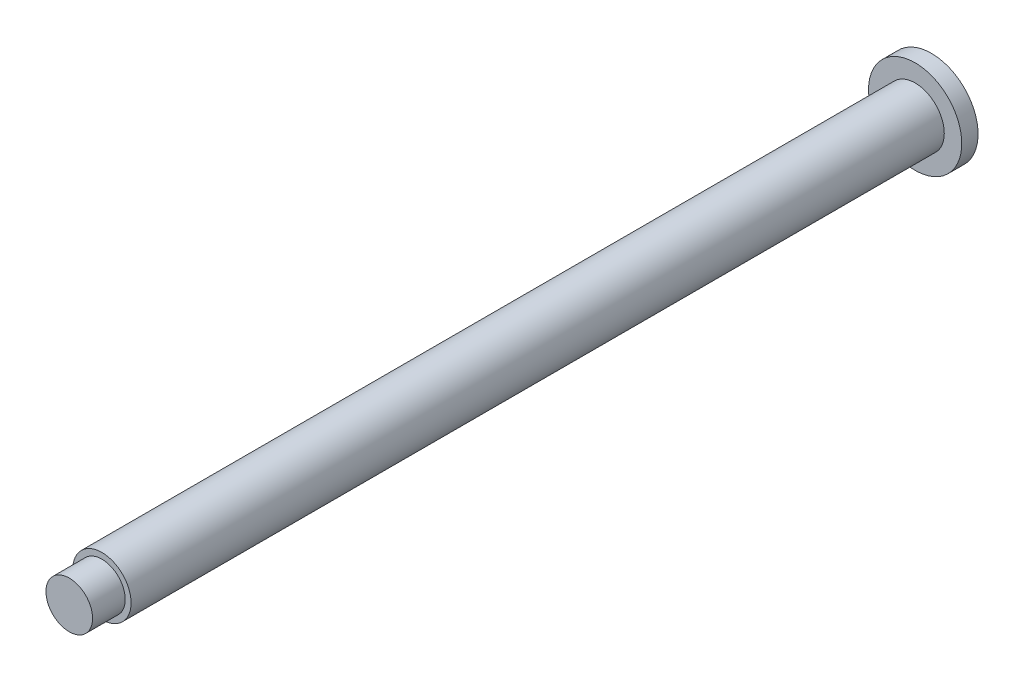
from build123d import *

# Parameters (mm, degrees)
SKETCH1_R           = 2.5
BOSS_EXTRUDE1_DEPTH = 69.75
SKETCH2_R           = 4
BOSS_EXTRUDE2_DEPTH = 1.4
SKETCH3_R           = 2.05
CUT_EXTRUDE1_DEPTH  = 3
SKETCH4_R           = 2
BOSS_EXTRUDE3_DEPTH = 2.8


with BuildPart() as part:
    # Sketch1 → Boss-Extrude1 (new body)
    with BuildSketch(Plane(origin=(0, 0, 0), x_dir=(0, 1, 0), z_dir=(0, 0, 1))):
        with Locations(Location((0, 0, 0), (0, 0, 270))):
            Circle(SKETCH1_R)
    extrude(amount=BOSS_EXTRUDE1_DEPTH)

    # Sketch2 → Boss-Extrude2 (add)
    with BuildSketch(Plane(origin=(0, 0, 0), x_dir=(1, 0, 0), z_dir=(0, 0, -1))):
        with Locations(Location((0, 0, 0), (0, 0, 180))):
            Circle(SKETCH2_R)
    extrude(amount=BOSS_EXTRUDE2_DEPTH)

    # Sketch3 → Cut-Extrude1 (cut)
    with BuildSketch(Plane(origin=(0, 0, -1.4), x_dir=(1, 0, 0), z_dir=(0, 0, -1))):
        with Locations(Location((0, 0, 0), (0, 0, 180))):
            Circle(SKETCH3_R)
    extrude(amount=-CUT_EXTRUDE1_DEPTH, mode=Mode.SUBTRACT)

    # Sketch4 → Boss-Extrude3 (add)
    with BuildSketch(Plane.XY.offset(69.75)):
        Circle(SKETCH4_R)
    extrude(amount=BOSS_EXTRUDE3_DEPTH)


solid = part.part
